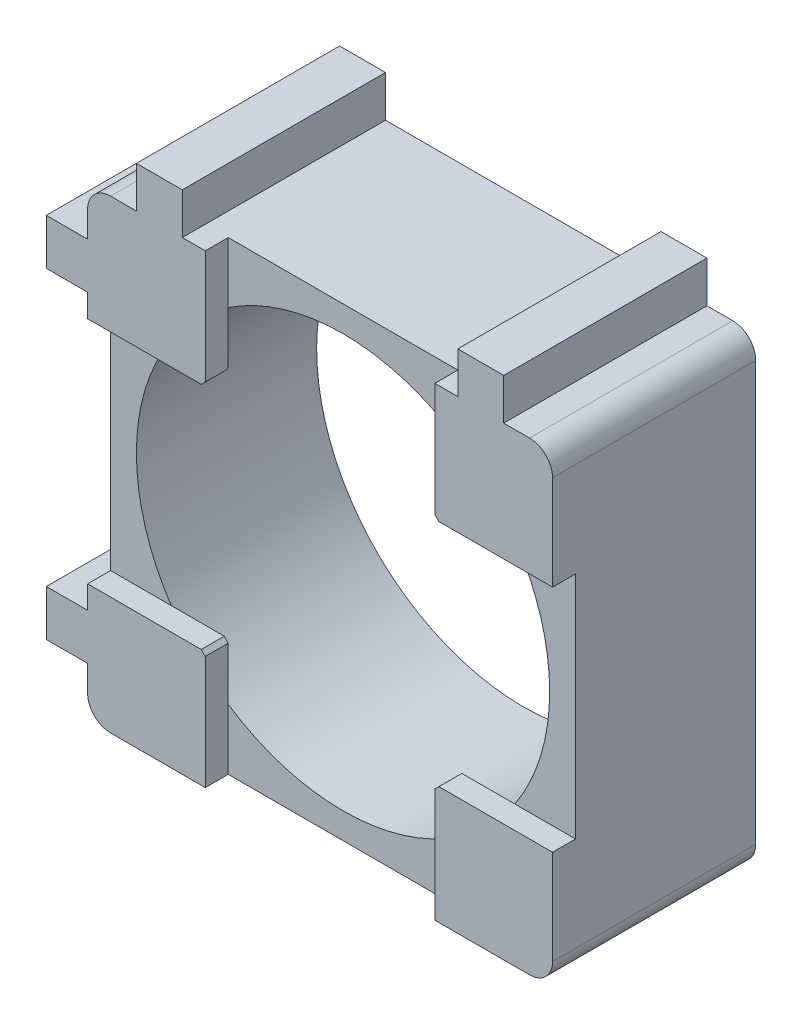
from build123d import *

# Parameters (mm, degrees)
SKETCH1_W           = 20.25
SKETCH1_H           = 20.25
SKETCH1_R           = 9
BOSS_EXTRUDE1_DEPTH = 4.425
BOSS_EXTRUDE2_START = -1
SKETCH2_R           = 9
SKETCH2_R_2         = 7.195345153
BOSS_EXTRUDE2_DEPTH = 1
CUT_EXTRUDE1_START  = -1
CUT_EXTRUDE1_DEPTH  = 1
FILLET1_R           = 1
SKETCH4_W           = 8.85
SKETCH4_H           = 2
BOSS_EXTRUDE3_DEPTH = 1.8
CIRPATTERN1_COUNT   = 2
CIRPATTERN1_ANGLE   = 90


with BuildPart() as part:
    # Sketch1 → Boss-Extrude1 (new, symmetric)
    with BuildSketch(Plane.XY):
        Rectangle(SKETCH1_W, SKETCH1_H)
        Circle(SKETCH1_R, mode=Mode.SUBTRACT)
    extrude(amount=BOSS_EXTRUDE1_DEPTH, both=True)

    # Sketch2 → Boss-Extrude2 (add)
    with BuildSketch(Plane.XY.offset(4.425).offset(BOSS_EXTRUDE2_START)):
        Circle(SKETCH2_R)
        Circle(SKETCH2_R_2, mode=Mode.SUBTRACT)
    extrude(amount=BOSS_EXTRUDE2_DEPTH)

    # Sketch3 → Cut-Extrude1 (cut)
    with BuildSketch(Plane.XY.offset(4.425).offset(CUT_EXTRUDE1_START)):
        with BuildLine():
            Line((-10.125, -5), (-5.174262446, -5))
            ThreePointArc((-5.174262446, -5), (-5.08787735, -5.08787735), (-5, -5.174262446))
            Line((-5, -5.174262446), (-5, -10.125))
            Line((-5, -10.125), (5, -10.125))
            Line((5, -10.125), (5, -5.174262446))
            ThreePointArc((5, -5.174262446), (5.08787735, -5.08787735), (5.174262446, -5))
            Line((5.174262446, -5), (10.125, -5))
            Line((10.125, -5), (10.125, 5))
            Line((10.125, 5), (5.174262446, 5))
            ThreePointArc((5.174262446, 5), (5.08787735, 5.08787735), (5, 5.174262446))
            Line((5, 5.174262446), (5, 10.125))
            Line((5, 10.125), (-5, 10.125))
            Line((-5, 10.125), (-5, 5.174262446))
            ThreePointArc((-5, 5.174262446), (-5.08787735, 5.08787735), (-5.174262446, 5))
            Line((-5.174262446, 5), (-10.125, 5))
            Line((-10.125, 5), (-10.125, -5))
        make_face()
    extrude(amount=CUT_EXTRUDE1_DEPTH, mode=Mode.SUBTRACT)

    # Fillet1
    fillet1_edges = [part.edges().sort_by_distance(p)[0] for p in [
        (-10.125, 10.125, 0),
        (10.125, 10.125, 0),
        (10.125, -10.125, 0),
        (-10.125, -10.125, 0),
    ]]
    fillet(fillet1_edges, radius=FILLET1_R)

    # Sketch4 → Boss-Extrude3 (add)
    with BuildSketch(Plane.ZY.offset(10.125)):
        with Locations((0, 7)):
            Rectangle(SKETCH4_W, SKETCH4_H)
        with Locations((0, -7)):
            Rectangle(SKETCH4_W, SKETCH4_H)
    boss_extrude3 = extrude(amount=BOSS_EXTRUDE3_DEPTH)

    # CirPattern1: Boss-Extrude3 ×2 about axis
    cirpattern1_axis = Axis((0, 0, 0), (0, 0, -1))
    for i in range(1, CIRPATTERN1_COUNT):
        add(boss_extrude3.rotate(cirpattern1_axis, i * CIRPATTERN1_ANGLE / (CIRPATTERN1_COUNT - 1)))


solid = part.part
